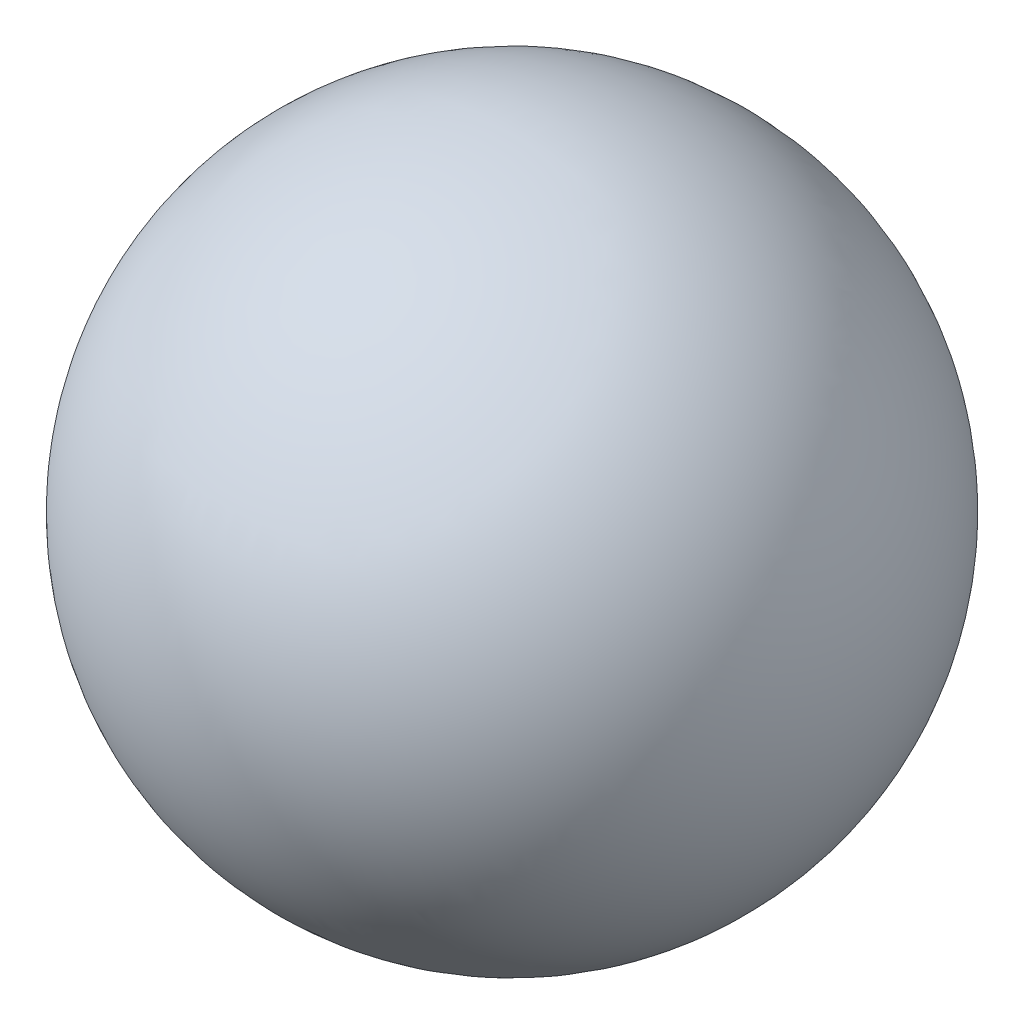
from build123d import *


with BuildPart() as part:
    # Esboço1 → Revolução1 (revolve)
    with BuildSketch(Plane.XY):
        with BuildLine():
            Line((-49.500004275, -27.0691653), (-57.49994349, -27.053750894))
            ThreePointArc((-57.49994349, -27.053750894), (-53.507707247, -31.075005642), (-49.500004275, -27.0691653))
        make_face()
    revolve(axis=Axis((-59.439842289, -27.050013067, 0), (0.9999981436964025, -0.0019268118095331125, 0)))


solid = part.part
